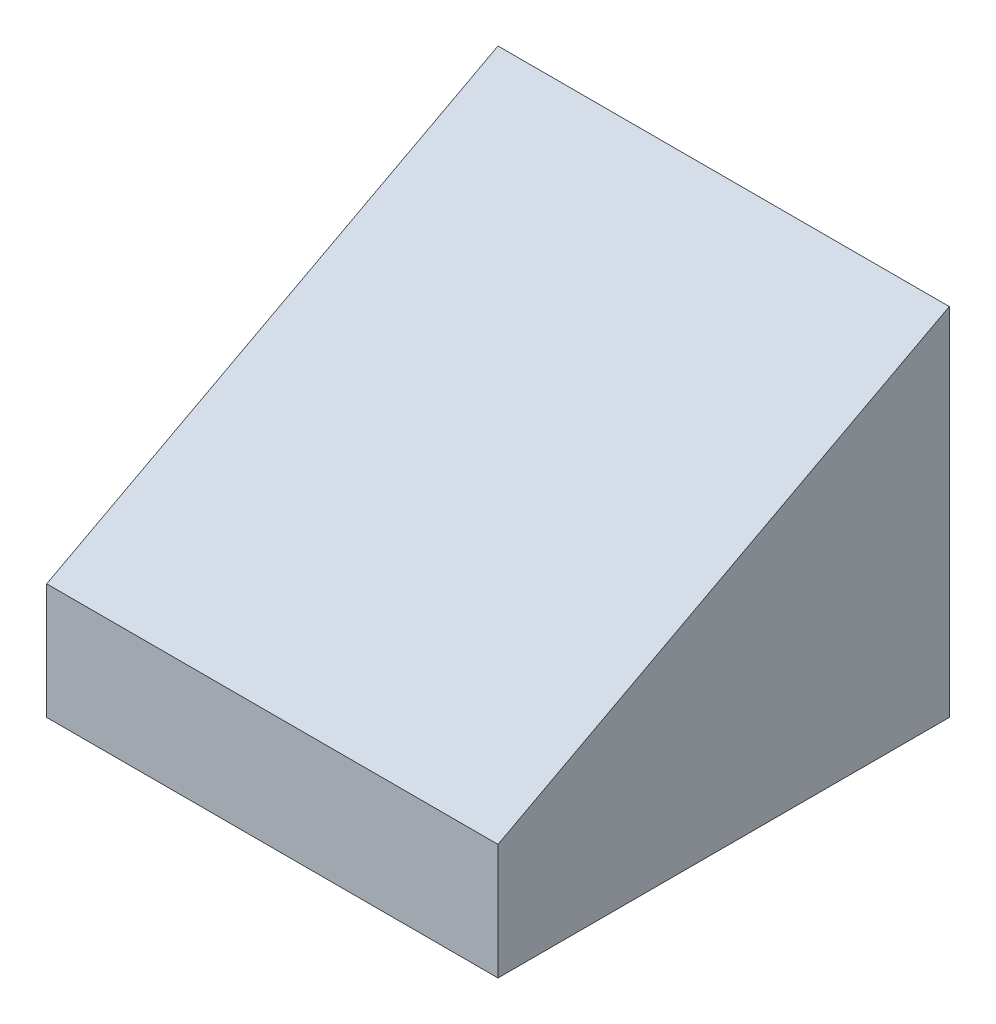
from build123d import *

# Parameters (mm, degrees)
BOSS_EXTRUDE1_DEPTH = 7.8
SHELL1_T            = -1.5


with BuildPart() as part:
    # Sketch1 → Boss-Extrude1 (new body)
    with BuildSketch(Plane(origin=(0, 0, 0), x_dir=(0, 0, -1), z_dir=(1, 0, 0))):
        Polygon((0, 0), (-7.8, 0), (-7.8, 2), (0, 6.15), align=None)
    extrude(amount=-BOSS_EXTRUDE1_DEPTH)

    # Shell1
    shell1_openings = [part.faces().sort_by_distance(p)[0] for p in [
        (-3.9, 0, 3.9),
    ]]
    offset(amount=SHELL1_T, openings=shell1_openings, kind=Kind.INTERSECTION)


solid = part.part
